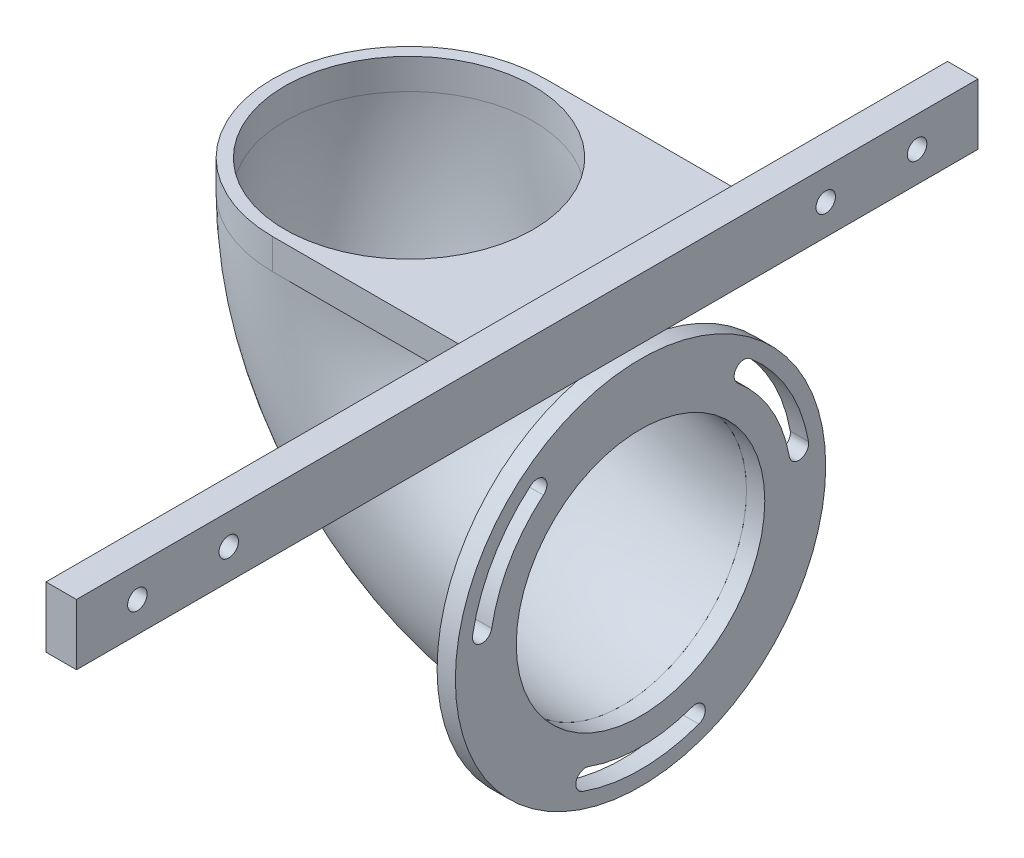
from build123d import *

# Parameters (mm, degrees)
SKETCH1_R           = 22.4
SKETCH1_R_2         = 20.4
REVOLVE1_ANGLE      = 90
SKETCH1_194_R       = 30.4
SKETCH1_194_R_2     = 20.4
BOSS_EXTRUDE1_DEPTH = 3
SKETCH4_R           = 20.4
BOSS_EXTRUDE3_DEPTH = 5
SKETCH5_W           = 148
SKETCH5_H           = 10
SKETCH5_R           = 1.6
BOSS_EXTRUDE4_DEPTH = 5


with BuildPart() as part:
    # Sketch1 → Revolve1 (revolve)
    with BuildSketch(Plane(origin=(0, 0, 0), x_dir=(0, 0, -1), z_dir=(1, 0, 0))):
        with Locations((0, -40)):
            Circle(SKETCH1_R)
        with Locations((0, -40)):
            Circle(SKETCH1_R_2, mode=Mode.SUBTRACT)
    revolve(axis=Axis((0, -5, 90.771329453), (0, 0, -1)), revolution_arc=REVOLVE1_ANGLE)

    # Sketch4 → Boss-Extrude3 (add)
    with BuildSketch(Plane(origin=(0, -5, 0), x_dir=(1, 0, 0), z_dir=(0, 1, 0))):
        with BuildLine():
            Line((3, -22.4), (3, 22.4))
            Line((3, 22.4), (-35, 22.4))
            ThreePointArc((-35, 22.4), (-57.4, 0), (-35, -22.4))
            Line((-35, -22.4), (3, -22.4))
        make_face()
        with Locations((-35, 0)):
            Circle(SKETCH4_R, mode=Mode.SUBTRACT)
    extrude(amount=BOSS_EXTRUDE3_DEPTH)

    # Sketch5 → Boss-Extrude4 (add)
    with BuildSketch(Plane(origin=(3, 0, 0), x_dir=(0, 0, -1), z_dir=(1, 0, 0))):
        with Locations((-18.6, -2.5)):
            Rectangle(SKETCH5_W, SKETCH5_H)
        with Locations((30.4, -2.5)):
            Circle(SKETCH5_R, mode=Mode.SUBTRACT)
        with Locations((45.4, -2.5)):
            Circle(SKETCH5_R, mode=Mode.SUBTRACT)
        with Locations((-82.6, -2.5)):
            Circle(SKETCH5_R, mode=Mode.SUBTRACT)
        with Locations((-67.6, -2.5)):
            Circle(SKETCH5_R, mode=Mode.SUBTRACT)
    extrude(amount=-BOSS_EXTRUDE4_DEPTH)


with BuildPart() as body_2:
    # Sketch1<194> → Boss-Extrude1 (new body)
    with BuildSketch(Plane(origin=(0, 0, 0), x_dir=(0, 0, -1), z_dir=(1, 0, 0))):
        with Locations((0, -40)):
            Circle(SKETCH1_194_R)
        with Locations((0, -40)):
            Circle(SKETCH1_194_R_2, mode=Mode.SUBTRACT)
        with BuildLine():
            ThreePointArc((9.576564013, -66.311393382), (0, -68), (-9.576564013, -66.311393382))
            ThreePointArc((-9.576564013, -66.311393382), (-10.532839977, -64.260652959), (-8.482099554, -63.304376995))
            ThreePointArc((-8.482099554, -63.304376995), (0, -64.8), (8.482099554, -63.304376995))
            ThreePointArc((8.482099554, -63.304376995), (10.532839977, -64.260652959), (9.576564013, -66.311393382))
        make_face(mode=Mode.SUBTRACT)
        with BuildLine():
            ThreePointArc((27.574617084, -35.137851025), (26.276761764, -36.991380514), (24.423232275, -35.693525194))
            ThreePointArc((24.423232275, -35.693525194), (21.477430014, -27.6), (15.94113272, -21.002097811))
            ThreePointArc((15.94113272, -21.002097811), (15.743921787, -18.747966526), (17.998053071, -18.550755593))
            ThreePointArc((17.998053071, -18.550755593), (24.248711306, -26), (27.574617084, -35.137851025))
        make_face(mode=Mode.SUBTRACT)
        with BuildLine():
            ThreePointArc((-27.574617084, -35.137851025), (-24.248711306, -26), (-17.998053071, -18.550755593))
            ThreePointArc((-17.998053071, -18.550755593), (-15.743921787, -18.747966526), (-15.94113272, -21.002097811))
            ThreePointArc((-15.94113272, -21.002097811), (-21.477430014, -27.6), (-24.423232275, -35.693525194))
            ThreePointArc((-24.423232275, -35.693525194), (-26.276761764, -36.991380514), (-27.574617084, -35.137851025))
        make_face(mode=Mode.SUBTRACT)
    extrude(amount=BOSS_EXTRUDE1_DEPTH)


solid = Compound([part.part, body_2.part])
